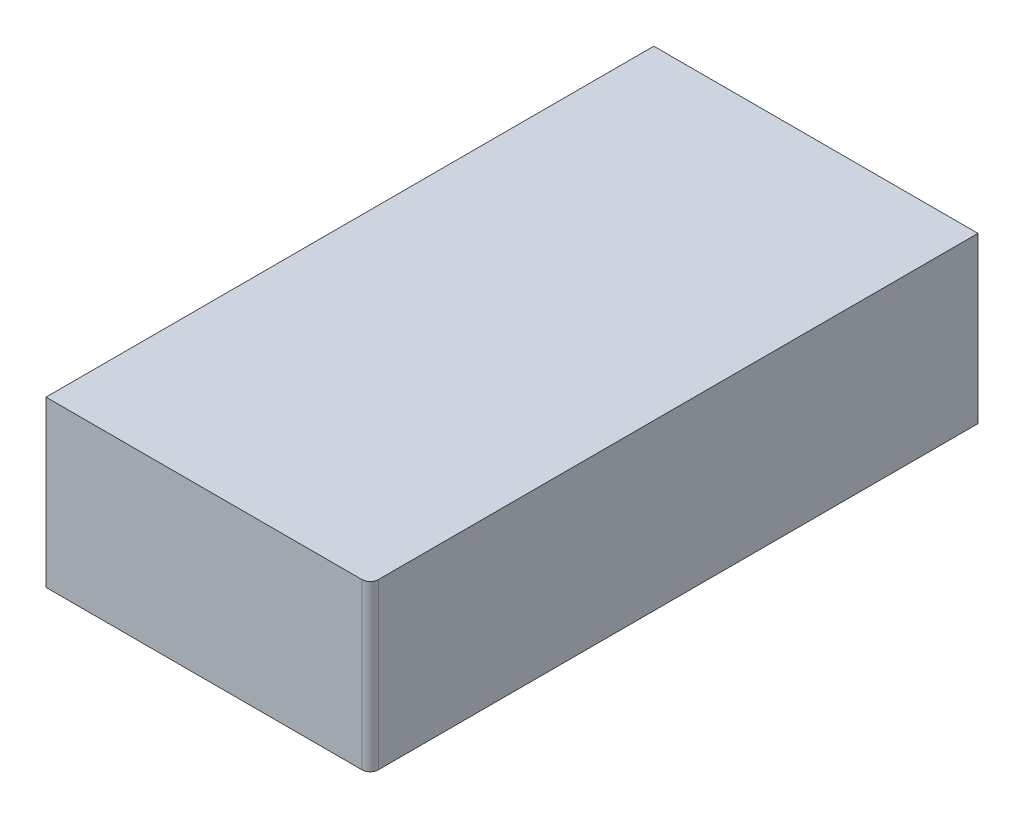
from build123d import *

# Parameters (mm, degrees)
SKETCH_1_W      = 120
SKETCH_1_H      = 61
EXTRUDE_1_DEPTH = 225
FILLET_1_R      = 3


with BuildPart() as part:
    # 草图1 → 凸台-拉伸1 (new body)
    with BuildSketch(Plane.XY):
        with Locations((365, -30.5)):
            Rectangle(SKETCH_1_W, SKETCH_1_H)
    extrude(amount=-EXTRUDE_1_DEPTH)

    # 圆角1
    fillet_1_edges = [part.edges().sort_by_distance(p)[0] for p in [
        (425, -30.5, 0),
    ]]
    fillet(fillet_1_edges, radius=FILLET_1_R)


solid = part.part
